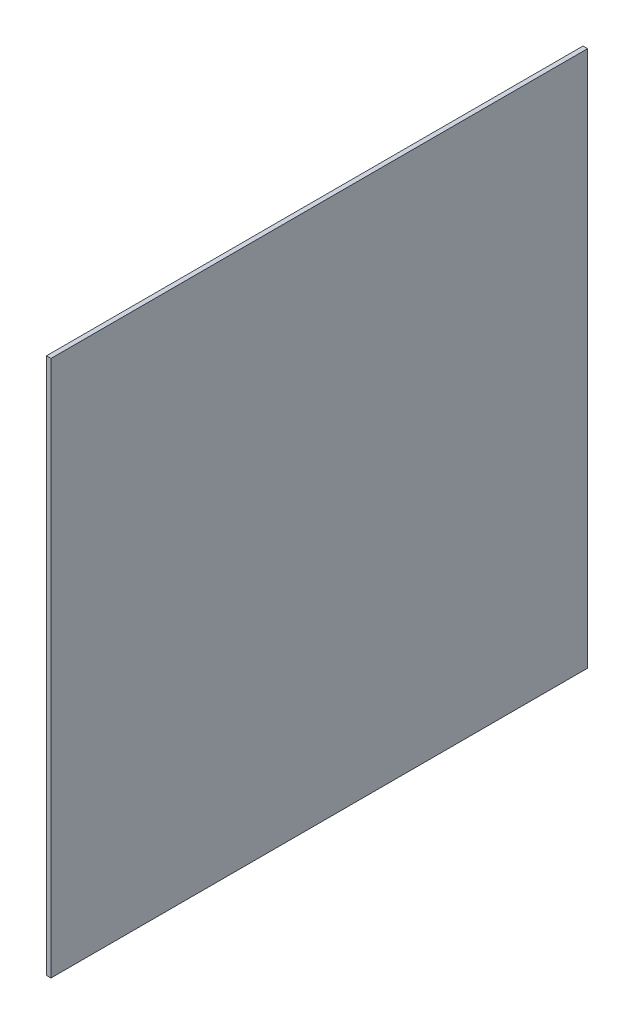
from build123d import *

# Parameters (mm, degrees)
SKETCH1_W           = 234.6
SKETCH1_H           = 234.6
BOSS_EXTRUDE1_DEPTH = 2


with BuildPart() as part:
    # Sketch1 → Boss-Extrude1 (new body)
    with BuildSketch(Plane(origin=(0, 0, 0), x_dir=(0, 0, -1), z_dir=(1, 0, 0))):
        Rectangle(SKETCH1_W, SKETCH1_H)
    extrude(amount=BOSS_EXTRUDE1_DEPTH)


solid = part.part
